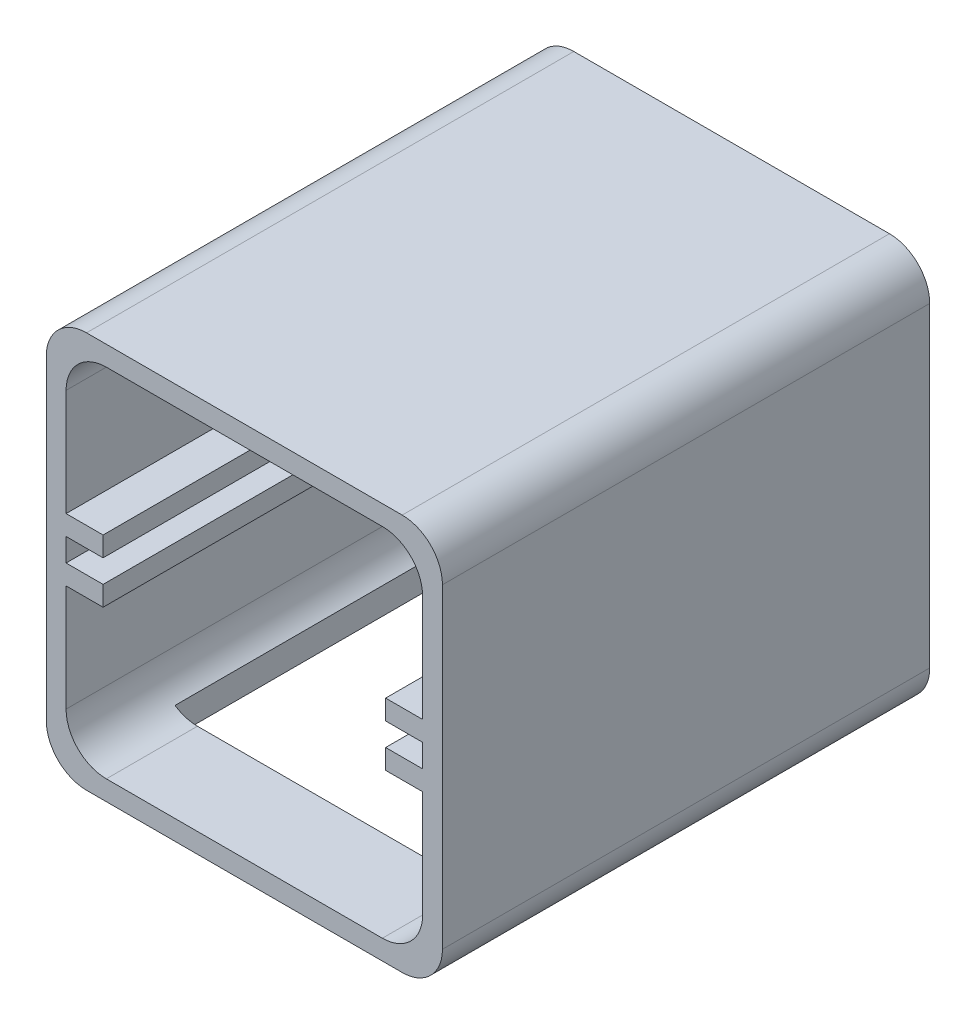
from build123d import *

# Parameters (mm, degrees)
SKETCH1_W           = 100
SKETCH1_H           = 100
BOSS_EXTRUDE1_DEPTH = 250
SKETCH2_W           = 90
SKETCH2_H           = 90
CUT_EXTRUDE1_DEPTH  = 288.228132327
FILLET1_R           = 10.16
SKETCH3_W           = 9.3412
SKETCH3_H           = 5
BOSS_EXTRUDE2_DEPTH = 250
SKETCH4_W           = 100
SKETCH4_H           = 125
CUT_EXTRUDE2_DEPTH  = 288.228132327
SKETCH6_W           = 81
SKETCH6_H           = 100
CUT_EXTRUDE4_DEPTH  = 5
FILLET3_R           = 10.16
BOSS_EXTRUDE3_DEPTH = 30.48
SKETCH9_W           = 73.406
SKETCH9_H           = 6.25
BOSS_EXTRUDE5_DEPTH = 35.052
CUT_EXTRUDE5_DEPTH  = 2


with BuildPart() as part:
    # Sketch1 → Boss-Extrude1 (new body)
    with BuildSketch(Plane.XY):
        with Locations((50, 50)):
            Rectangle(SKETCH1_W, SKETCH1_H)
    extrude(amount=BOSS_EXTRUDE1_DEPTH)

    # Sketch2 → Cut-Extrude1 (cut, through all)
    with BuildSketch(Plane(origin=(0, 0, 0), x_dir=(-1, 0, 0), z_dir=(0, 0, -1))):
        with Locations((-50, 50)):
            Rectangle(SKETCH2_W, SKETCH2_H)
    extrude(amount=-CUT_EXTRUDE1_DEPTH, mode=Mode.SUBTRACT)

    # Fillet1
    fillet1_edges = [part.edges().sort_by_distance(p)[0] for p in [
        (0, 100, 125),
        (0, 0, 125),
        (100, 0, 125),
        (100, 100, 125),
    ]]
    fillet(fillet1_edges, radius=FILLET1_R)

    # Sketch3 → Boss-Extrude2 (add, through all)
    with BuildSketch(Plane(origin=(0, 0, 0), x_dir=(-1, 0, 0), z_dir=(0, 0, -1))):
        with Locations((-90.3294, 55.4)):
            Rectangle(SKETCH3_W, SKETCH3_H)
        with Locations((-90.3294, 44.6)):
            Rectangle(SKETCH3_W, SKETCH3_H)
        with Locations((-9.6706, 44.6)):
            Rectangle(SKETCH3_W, SKETCH3_H)
        with Locations((-9.6706, 55.4)):
            Rectangle(SKETCH3_W, SKETCH3_H)
    extrude(amount=-BOSS_EXTRUDE2_DEPTH)

    # Sketch4 → Cut-Extrude2 (cut, through all)
    with BuildSketch(Plane(origin=(0, 100, 0), x_dir=(1, 0, 0), z_dir=(0, 1, 0))):
        with Locations((50, -62.5)):
            Rectangle(SKETCH4_W, SKETCH4_H)
    extrude(amount=-CUT_EXTRUDE2_DEPTH, mode=Mode.SUBTRACT)

    # Sketch6 → Cut-Extrude4 (cut)
    with BuildSketch(Plane.XZ):
        with Locations((50, 175)):
            Rectangle(SKETCH6_W, SKETCH6_H)
    extrude(amount=-CUT_EXTRUDE4_DEPTH, mode=Mode.SUBTRACT)

    # Fillet3
    fillet3_edges = [part.edges().sort_by_distance(p)[0] for p in [
        (5, 95, 187.5),
        (5, 5, 187.5),
        (95, 95, 187.5),
        (95, 5, 187.5),
    ]]
    fillet(fillet3_edges, radius=FILLET3_R)

    # Sketch7 → Boss-Extrude3 (add)
    with BuildSketch(Plane(origin=(0, 0, 125), x_dir=(-1, 0, 0), z_dir=(0, 0, -1))):
        Polygon((-95, 96), (-5, 96), (-5, 57.9), (-13.297, 57.9), (-13.297, 92.952), (-86.703, 92.952), (-86.703, 57.9), (-95, 57.9), align=None)
    extrude(amount=-BOSS_EXTRUDE3_DEPTH)

    # Sketch9 → Boss-Extrude5 (add)
    with BuildSketch(Plane.XZ.offset(-92.952)):
        with Locations((50, 152.355)):
            Rectangle(SKETCH9_W, SKETCH9_H)
    extrude(amount=BOSS_EXTRUDE5_DEPTH)

    # Sketch10 → Cut-Extrude5 (cut)
    with BuildSketch(Plane.XY.offset(250)):
        with BuildLine():
            Line((89.84, 100), (10.16, 100))
            ThreePointArc((10.16, 100), (2.975795103, 97.024204897), (0, 89.84))
            Line((0, 89.84), (0, 10.16))
            ThreePointArc((0, 10.16), (2.975795103, 2.975795103), (10.16, 0))
            Line((10.16, 0), (89.84, 0))
            ThreePointArc((89.84, 0), (97.024204897, 2.975795103), (100, 10.16))
            Line((100, 10.16), (100, 89.84))
            ThreePointArc((100, 89.84), (97.024204897, 97.024204897), (89.84, 100))
        make_face()
    extrude(amount=-CUT_EXTRUDE5_DEPTH, mode=Mode.SUBTRACT)


solid = part.part
